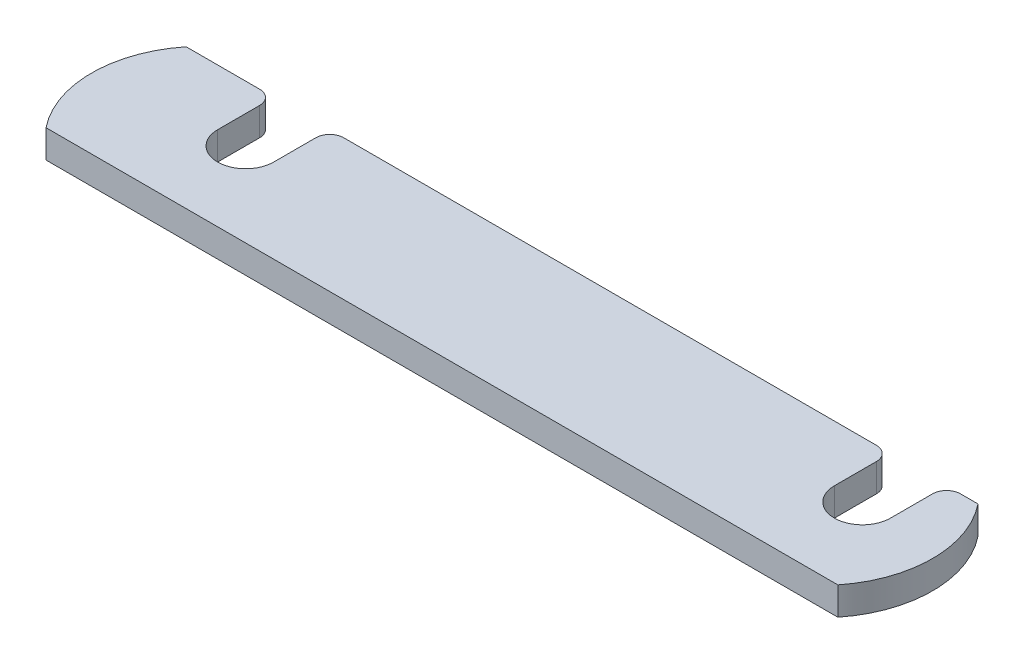
from build123d import *

# Parameters (mm, degrees)
RESSALTO_EXTRUS_O2_DEPTH = 2


with BuildPart() as part:
    # Esboço1 → Ressalto-extrusão2 (new body)
    with BuildSketch(Plane(origin=(0, 0, 0), x_dir=(1, 0, 0), z_dir=(0, 1, 0))):
        with BuildLine():
            Line((-28.244997998, 5), (-23, 5))
            ThreePointArc((-23, 5), (-22.292893219, 4.707106781), (-22, 4))
            Line((-22, 4), (-22, 1))
            ThreePointArc((-22, 1), (-20, -1), (-18, 1))
            Line((-18, 1), (-18, 4))
            ThreePointArc((-18, 4), (-17.707106781, 4.707106781), (-17, 5))
            Line((-17, 5), (21, 5))
            ThreePointArc((21, 5), (21.707106781, 4.707106781), (22, 4))
            Line((22, 4), (22, 1))
            ThreePointArc((22, 1), (24, -1), (26, 1))
            Line((26, 1), (26, 4))
            ThreePointArc((26, 4), (26.292893219, 4.707106781), (27, 5))
            Line((27, 5), (28.244997998, 5))
            ThreePointArc((28.244997998, 5), (30, 0), (28.244997998, -5))
            Line((28.244997998, -5), (-28.244997998, -5))
            ThreePointArc((-28.244997998, -5), (-30, 0), (-28.244997998, 5))
        make_face()
    extrude(amount=RESSALTO_EXTRUS_O2_DEPTH)


solid = part.part
